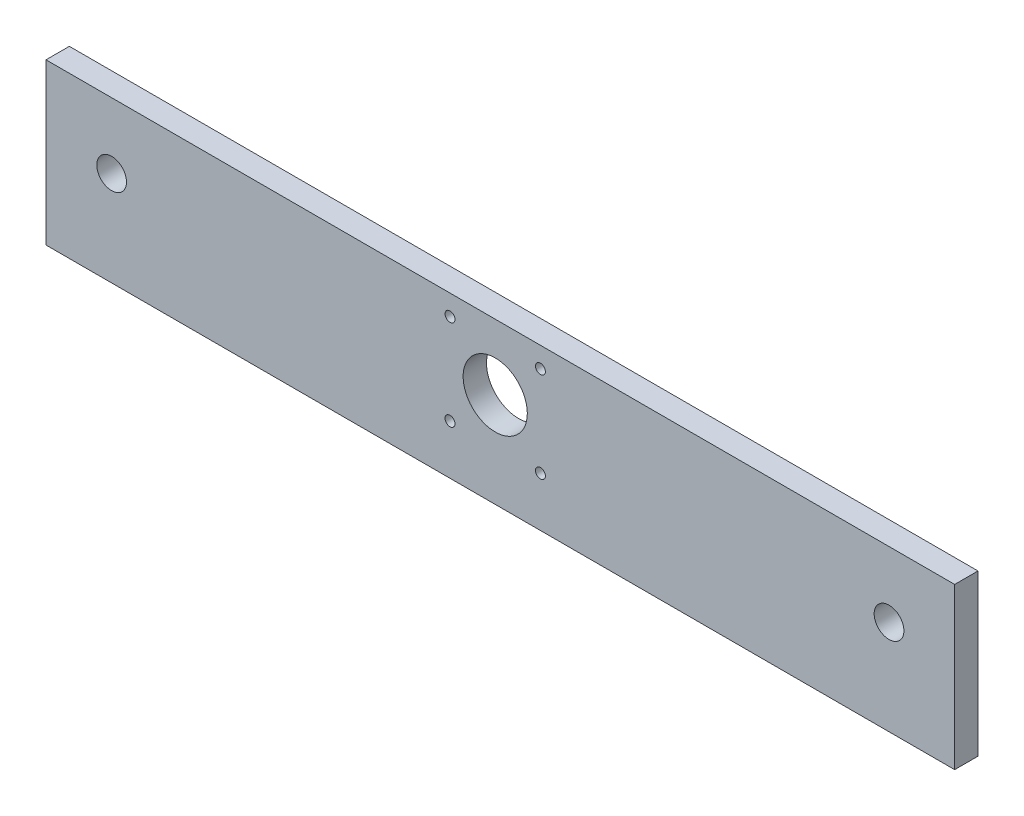
from build123d import *

# Parameters (mm, degrees)
SKETCH1_W                                           = 311.5
SKETCH1_H                                           = 45
BOSS_EXTRUDE1_DEPTH                                 = 4
SKETCH5_R                                           = 11
SKETCH5_R_2                                         = 1.25
CUT_EXTRUDE1_DEPTH                                  = 158.570024116
CBORE_FOR_M3_HEX_SOCKET_HEAD_CAP_SCREW1_D           = 3.4
CBORE_FOR_M3_HEX_SOCKET_HEAD_CAP_SCREW1_CBORE_D     = 6.5
CBORE_FOR_M3_HEX_SOCKET_HEAD_CAP_SCREW1_CBORE_DEPTH = 3.4
F_10_2_10_2_DIAMETER_HOLE1_D                        = 10.2
SKETCH14_W                                          = 311.5
SKETCH14_H                                          = 10
BOSS_EXTRUDE2_DEPTH                                 = 8


with BuildPart() as part:
    # Sketch1 → Boss-Extrude1 (new, symmetric)
    with BuildSketch(Plane.XY):
        Rectangle(SKETCH1_W, SKETCH1_H)
    extrude(amount=BOSS_EXTRUDE1_DEPTH, both=True)

    # Sketch5 → Cut-Extrude1 (cut, through all)
    with BuildSketch(Plane.XY.offset(4)):
        with Locations((-1.75, 0)):
            Circle(SKETCH5_R)
        with Locations((-17.25, 15.5)):
            Circle(SKETCH5_R_2)
        with Locations((13.75, 15.5)):
            Circle(SKETCH5_R_2)
        with Locations((13.75, -15.5)):
            Circle(SKETCH5_R_2)
        with Locations((-17.25, -15.5)):
            Circle(SKETCH5_R_2)
    extrude(amount=-CUT_EXTRUDE1_DEPTH, mode=Mode.SUBTRACT)

    # CBORE for M3 Hex Socket Head Cap Screw1 (through all)
    with Locations(Plane(origin=(0, 0, -4), x_dir=(-1, 0, 0), z_dir=(0, 0, -1))):
        with Locations((-13.75, 15.5), (17.25, 15.5), (17.25, -15.5), (-13.75, -15.5)):
            CounterBoreHole(CBORE_FOR_M3_HEX_SOCKET_HEAD_CAP_SCREW1_D / 2, CBORE_FOR_M3_HEX_SOCKET_HEAD_CAP_SCREW1_CBORE_D / 2, CBORE_FOR_M3_HEX_SOCKET_HEAD_CAP_SCREW1_CBORE_DEPTH)

    # Ø10.2 (10.2) Diameter Hole1 (through all)
    with Locations(Plane.XY.offset(4)):
        with Locations((-133.249958454, 1.369e-06), (133.249998631, 1.369e-06)):
            Hole(F_10_2_10_2_DIAMETER_HOLE1_D / 2)

    # Sketch14 → Boss-Extrude2 (add)
    with BuildSketch(Plane.XY.offset(4)):
        with Locations((0, -27.5)):
            Rectangle(SKETCH14_W, SKETCH14_H)
    extrude(amount=-BOSS_EXTRUDE2_DEPTH)


solid = part.part
